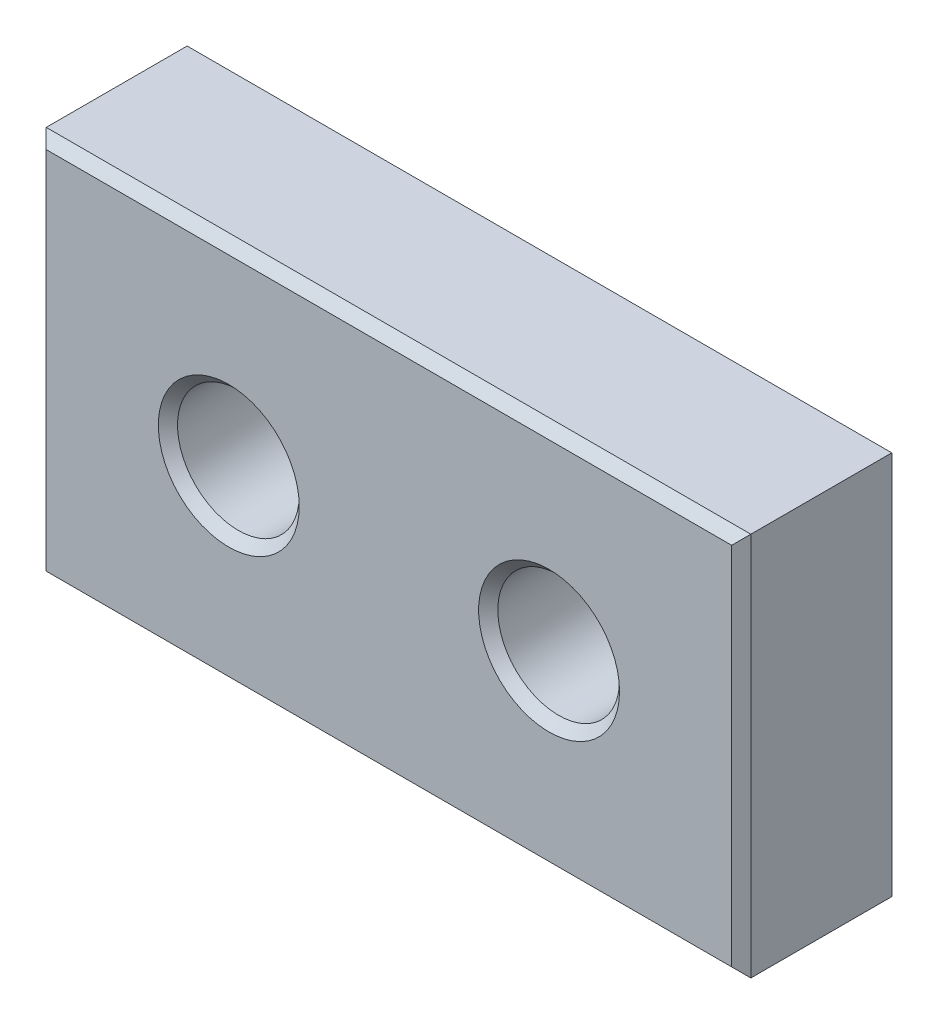
from build123d import *

# Parameters (mm, degrees)
SKETCH_1_W      = 22
SKETCH_1_H      = 12
SKETCH_1_R      = 1.9
EXTRUDE_1_DEPTH = 5
CHAMFER_1_SIZE  = 0.3


with BuildPart() as part:
    # 스케치1 → 보스-돌출1 (new body)
    with BuildSketch(Plane.XY):
        Rectangle(SKETCH_1_W, SKETCH_1_H)
        with Locations((-5, 0)):
            Circle(SKETCH_1_R, mode=Mode.SUBTRACT)
        with Locations(Location((5, 0, 0), (0, 0, 180))):
            Circle(SKETCH_1_R, mode=Mode.SUBTRACT)
    extrude(amount=EXTRUDE_1_DEPTH)

    # 모따기1
    chamfer_1_edges = [part.edges().sort_by_distance(p)[0] for p in [
        (-6.9, 0, 0),
        (-6.9, 0, 5),
        (-11, 0, 5),
        (6.9, 0, 0),
        (6.9, 0, 5),
        (0, -6, 5),
        (11, 0, 5),
        (0, -6, 0),
        (-11, 0, 0),
        (0, 6, 0),
        (11, 0, 0),
        (0, 6, 5),
    ]]
    chamfer(chamfer_1_edges, length=CHAMFER_1_SIZE)


solid = part.part
